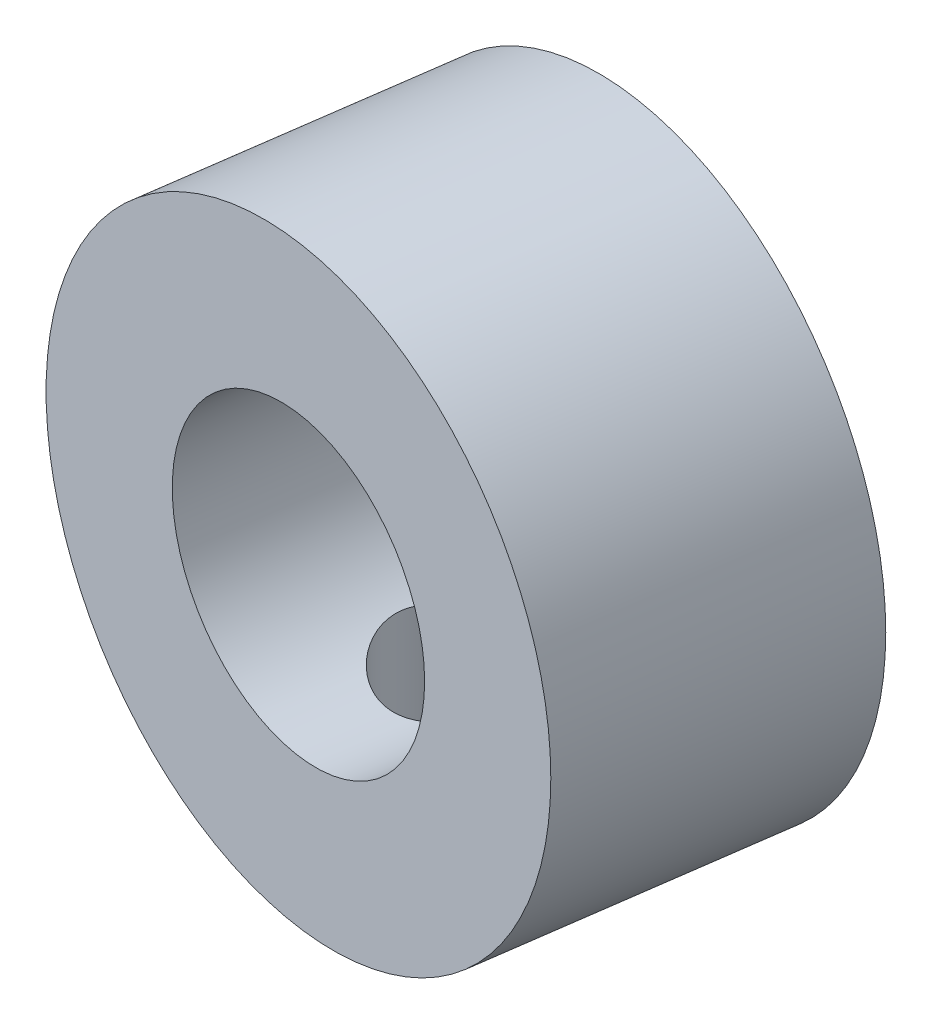
from build123d import *

# Parameters (mm, degrees)
SKETCH1_W                 = 6.35
SKETCH1_H                 = 3.175
F_6_32_TAPPED_HOLE1_D     = 2.7051
F_6_32_TAPPED_HOLE1_DEPTH = 6.35
F_6_32_TAPPED_HOLE1_TIP   = 0.81269403


with BuildPart() as part:
    # Sketch1 → Revolve1 (revolve)
    with BuildSketch(Plane(origin=(-29.958526336, -0.005469007, 37.92245832), x_dir=(0.13925483139909497, 0, -0.9902565788380351), z_dir=(0.9894272351965835, -0.04091828655590667, 0.13913820494951587)), mode=Mode.PRIVATE) as revolve1_sk:
        with Locations((53.390881452, -11.292628037)):
            Rectangle(SKETCH1_W, SKETCH1_H)
    revolve(revolve1_sk.sketch.rotate(Axis((-23.230320423, -6.530128037, -11.84135777), (0.13925483139909509, 0, -0.9902565788380351)), 267.654900162), axis=Axis((-23.230320423, -6.530128037, -11.84135777), (0.13925483139909509, 0, -0.9902565788380351)))

    # #6-32 Tapped Hole1
    with Locations(Plane(origin=(0, -12.880128037, 0), x_dir=(-1, 0, 0), z_dir=(0, -1, 0))):
        with Locations((23.045485809, 15.021605147)):
            Hole(F_6_32_TAPPED_HOLE1_D / 2, depth=F_6_32_TAPPED_HOLE1_DEPTH)
            with Locations((0, 0, -(F_6_32_TAPPED_HOLE1_DEPTH + F_6_32_TAPPED_HOLE1_TIP / 2))):  # 118° drill point
                Cone(0, F_6_32_TAPPED_HOLE1_D / 2, F_6_32_TAPPED_HOLE1_TIP, mode=Mode.SUBTRACT)


solid = part.part
